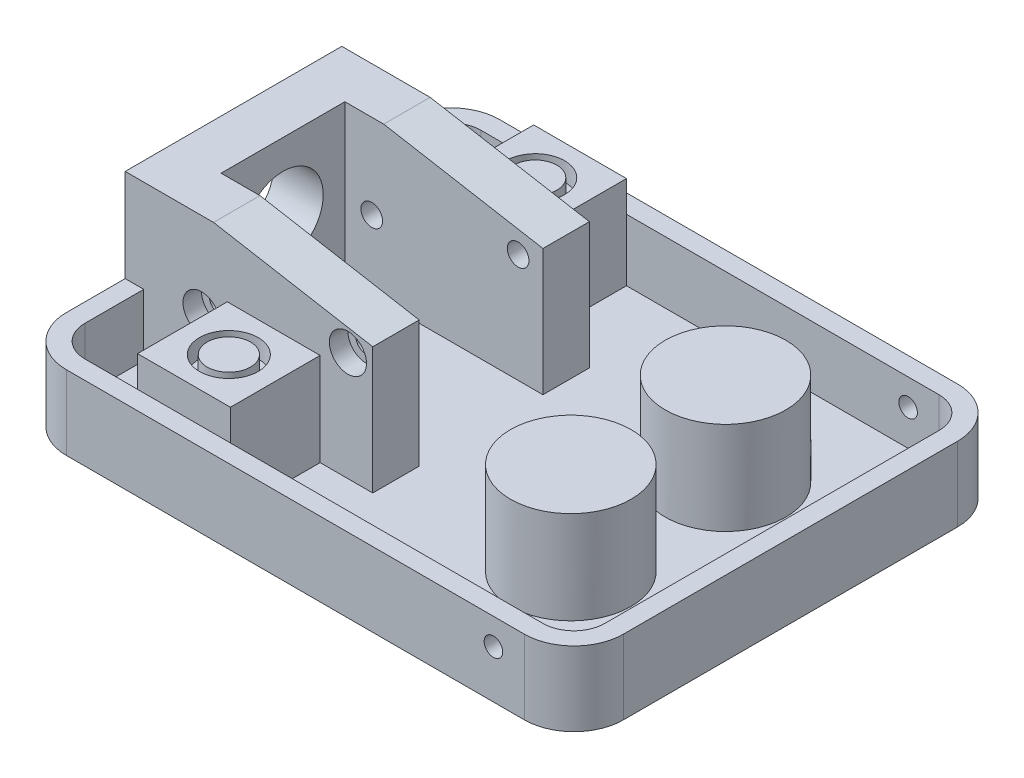
from build123d import *

# Parameters (mm, degrees)
BOSS_EXTRUDE1_DEPTH = 25
CUT_EXTRUDE1_REACH  = 60.737
SKETCH2_R           = 1.75
BOSS_EXTRUDE2_DEPTH = 10
BOSS_EXTRUDE3_START = 2
BOSS_EXTRUDE3_DEPTH = 2
SKETCH5_R           = 1.5
CUT_EXTRUDE2_DEPTH  = 117.726175299
SKETCH6_R           = 3
SKETCH6_R_2         = 1.75
CUT_EXTRUDE3_DEPTH  = 3
CUT_EXTRUDE4_START  = -3
SKETCH7_R           = 1.75
CUT_EXTRUDE4_DEPTH  = 3
SKETCH8_W           = 15
SKETCH8_H           = 14.5
BOSS_EXTRUDE4_DEPTH = 15
SKETCH9_R           = 4.75
SKETCH9_R_2         = 3.5
CUT_EXTRUDE5_DEPTH  = 3
SKETCH11_R          = 9.75
BOSS_EXTRUDE5_DEPTH = 15
CUT_EXTRUDE6_REACH  = 109.151


with BuildPart() as part:
    # Sketch1 → Boss-Extrude1 (new body)
    with BuildSketch(Plane(origin=(0, 0, 0), x_dir=(1, 0, 0), z_dir=(0, 1, 0))):
        Polygon((40, 7.5), (8, 7.5), (8, 27.5), (40, 27.5), (40, 35), (0, 35), (0, 0), (40, 0), align=None)
    extrude(amount=BOSS_EXTRUDE1_DEPTH)

    # Cut-Extrude1: up to this face of the body (flat: up to its plane)
    cut_extrude1_end = Plane(part.part.faces().sort_by_distance((20, 12.5, -35))[0])
    # Sketch2 → Cut-Extrude1 (cut, up to the picked face)
    with BuildSketch(Plane.XY, mode=Mode.PRIVATE) as cut_extrude1_sk1:
        with Locations((35.988510068, 17.617712577)):
            Circle(SKETCH2_R)
    cut_extrude1_tool1 = split(extrude(cut_extrude1_sk1.sketch, amount=-CUT_EXTRUDE1_REACH, mode=Mode.PRIVATE), bisect_by=cut_extrude1_end, keep=Keep.BOTH, mode=Mode.PRIVATE)
    # Sketch2 → Cut-Extrude1 (cut, up to the picked face)
    with BuildSketch(Plane.XY, mode=Mode.PRIVATE) as cut_extrude1_sk2:
        with Locations((12.337201721, 11.329182265)):
            Circle(SKETCH2_R)
    cut_extrude1_tool2 = split(extrude(cut_extrude1_sk2.sketch, amount=-CUT_EXTRUDE1_REACH, mode=Mode.PRIVATE), bisect_by=cut_extrude1_end, keep=Keep.BOTH, mode=Mode.PRIVATE)
    # Sketch2 → Cut-Extrude1 (cut, up to the picked face)
    with BuildSketch(Plane.XY, mode=Mode.PRIVATE) as cut_extrude1_sk3:
        Polygon((40, 25), (14.27717431, 25), (40, 20.464371811), align=None)
    cut_extrude1_tool3 = split(extrude(cut_extrude1_sk3.sketch, amount=-CUT_EXTRUDE1_REACH, mode=Mode.PRIVATE), bisect_by=cut_extrude1_end, keep=Keep.BOTH, mode=Mode.PRIVATE)
    add(cut_extrude1_tool1.solids().sort_by(Axis((35.98851, 17.617713, 0), (0, 0, -1)))[0], mode=Mode.SUBTRACT)
    add(cut_extrude1_tool2.solids().sort_by(Axis((12.337202, 11.329182, 0), (0, 0, -1)))[0], mode=Mode.SUBTRACT)
    add(cut_extrude1_tool3.solids().sort_by(Axis((31.425725, 23.488124, 0), (0, 0, -1)))[0], mode=Mode.SUBTRACT)

    # Sketch3 → Boss-Extrude2 (add)
    with BuildSketch(Plane.XZ):
        with BuildLine():
            ThreePointArc((82, 14.5), (85.535533906, 13.035533906), (87, 9.5))
            Line((87, 9.5), (87, -44.5))
            ThreePointArc((87, -44.5), (85.535533906, -48.035533906), (82, -49.5))
            Line((82, -49.5), (8, -49.5))
            ThreePointArc((8, -49.5), (4.464466094, -48.035533906), (3, -44.5))
            Line((3, -44.5), (3, -35))
            Line((3, -35), (0, -35))
            Line((0, -35), (0, -44.5))
            ThreePointArc((0, -44.5), (2.343145751, -50.156854249), (8, -52.5))
            Line((8, -52.5), (82, -52.5))
            ThreePointArc((82, -52.5), (87.656854249, -50.156854249), (90, -44.5))
            Line((90, -44.5), (90, 9.5))
            ThreePointArc((90, 9.5), (87.656854249, 15.156854249), (82, 17.5))
            Line((82, 17.5), (8, 17.5))
            ThreePointArc((8, 17.5), (2.343145751, 15.156854249), (0, 9.5))
            Line((0, 9.5), (0, 0))
            Line((0, 0), (3, 0))
            Line((3, 0), (3, 9.5))
            ThreePointArc((3, 9.5), (4.464466094, 13.035533906), (8, 14.5))
            Line((8, 14.5), (82, 14.5))
        make_face()
    extrude(amount=-BOSS_EXTRUDE2_DEPTH)

    # Sketch4 → Boss-Extrude3 (add)
    with BuildSketch(Plane.XZ.offset(BOSS_EXTRUDE3_START)):
        with BuildLine():
            Line((82, -52.5), (8, -52.5))
            ThreePointArc((8, -52.5), (2.343145751, -50.156854249), (0, -44.5))
            Line((0, -44.5), (0, 9.5))
            ThreePointArc((0, 9.5), (2.343145751, 15.156854249), (8, 17.5))
            Line((8, 17.5), (82, 17.5))
            ThreePointArc((82, 17.5), (87.656854249, 15.156854249), (90, 9.5))
            Line((90, 9.5), (90, -44.5))
            ThreePointArc((90, -44.5), (87.656854249, -50.156854249), (82, -52.5))
        make_face()
    extrude(amount=-BOSS_EXTRUDE3_DEPTH)

    # Sketch5 → Cut-Extrude2 (cut, through all)
    with BuildSketch(Plane.XY.offset(17.5)):
        with Locations((77, 5.747215229)):
            Circle(SKETCH5_R)
    extrude(amount=-CUT_EXTRUDE2_DEPTH, mode=Mode.SUBTRACT)

    # Sketch6 → Cut-Extrude3 (cut)
    # profile 1 of 2: a face of its own
    with BuildSketch(Plane.XY):
        with Locations((12.337201721, 11.329182265)):
            Circle(SKETCH6_R)
        with Locations((12.337201721, 11.329182265)):
            Circle(SKETCH6_R_2, mode=Mode.SUBTRACT)
    # profile 2 of 2: a face of its own
    with BuildSketch(Plane.XY):
        with Locations((35.988510068, 17.617712577)):
            Circle(SKETCH6_R)
        with Locations((35.988510068, 17.617712577)):
            Circle(SKETCH6_R_2, mode=Mode.SUBTRACT)
    extrude(amount=-CUT_EXTRUDE3_DEPTH, mode=Mode.SUBTRACT)

    # Sketch7 → Cut-Extrude4 (cut)
    # profile 1 of 2: a face of its own
    with BuildSketch(Plane(origin=(0, 0, -35), x_dir=(-1, 0, 0), z_dir=(0, 0, -1)).offset(CUT_EXTRUDE4_START)):
        Polygon((-37.576223308, 14.867712577), (-34.400796828, 14.867712577), (-32.813083587, 17.617712577), (-34.400796828, 20.367712577), (-37.576223308, 20.367712577), (-39.163936548, 17.617712577), align=None)
        with Locations((-35.988510068, 17.617712577)):
            Circle(SKETCH7_R, mode=Mode.SUBTRACT)
    # profile 2 of 2: a face of its own
    with BuildSketch(Plane(origin=(0, 0, -35), x_dir=(-1, 0, 0), z_dir=(0, 0, -1)).offset(CUT_EXTRUDE4_START)):
        Polygon((-13.924914961, 8.579182265), (-10.749488481, 8.579182265), (-9.16177524, 11.329182265), (-10.749488481, 14.079182265), (-13.924914961, 14.079182265), (-15.512628201, 11.329182265), align=None)
        with Locations((-12.337201721, 11.329182265)):
            Circle(SKETCH7_R, mode=Mode.SUBTRACT)
    extrude(amount=CUT_EXTRUDE4_DEPTH, mode=Mode.SUBTRACT)

    # Sketch8 → Boss-Extrude4 (add)
    with BuildSketch(Plane(origin=(0, 0, 0), x_dir=(1, 0, 0), z_dir=(0, 1, 0))):
        with Locations((24, -7.25)):
            Rectangle(SKETCH8_W, SKETCH8_H)
        with Locations((24, 42.25)):
            Rectangle(SKETCH8_W, SKETCH8_H)
    extrude(amount=BOSS_EXTRUDE4_DEPTH)

    # Sketch9 → Cut-Extrude5 (cut)
    # profile 1 of 2: a face of its own
    with BuildSketch(Plane(origin=(0, 15, 0), x_dir=(1, 0, 0), z_dir=(0, 1, 0))):
        with Locations(Location((24, 42.25, 0), (0, 0, 270))):
            Circle(SKETCH9_R)
        with Locations(Location((24, 42.25, 0), (0, 0, 270))):
            Circle(SKETCH9_R_2, mode=Mode.SUBTRACT)
    # profile 2 of 2: a face of its own
    with BuildSketch(Plane(origin=(0, 15, 0), x_dir=(1, 0, 0), z_dir=(0, 1, 0))):
        with Locations(Location((24, -7.25, 0), (0, 0, 270))):
            Circle(SKETCH9_R)
        with Locations(Location((24, -7.25, 0), (0, 0, 270))):
            Circle(SKETCH9_R_2, mode=Mode.SUBTRACT)
    extrude(amount=-CUT_EXTRUDE5_DEPTH, mode=Mode.SUBTRACT)

    # Sketch11 → Boss-Extrude5 (add)
    with BuildSketch(Plane(origin=(0, 0, 0), x_dir=(1, 0, 0), z_dir=(0, 1, 0))):
        with Locations(Location((67, 30, 0), (0, 0, 90))):
            Circle(SKETCH11_R)
        with Locations(Location((67, 5, 0), (0, 0, 90))):
            Circle(SKETCH11_R)
    extrude(amount=BOSS_EXTRUDE5_DEPTH)

    # Sketch12 → Cut-Extrude6 (cut, up to next)
    with BuildSketch(Plane.ZY, mode=Mode.PRIVATE) as cut_extrude6_sk1:
        with BuildLine():
            Line((-20, 7.759198983), (-20, 2.5))
            ThreePointArc((-20, 2.5), (-17.5, 0), (-15, 2.5))
            Line((-15, 2.5), (-15, 7.759198983))
            ThreePointArc((-15, 7.759198983), (-17.5, 20.259198983), (-20, 7.759198983))
        make_face()
    cut_extrude6_tool1 = extrude(cut_extrude6_sk1.sketch, amount=-CUT_EXTRUDE6_REACH, mode=Mode.PRIVATE) & part.part
    add(cut_extrude6_tool1.solids().sort_by_distance((0, 11.74048, -17.5))[0], mode=Mode.SUBTRACT)


solid = part.part
